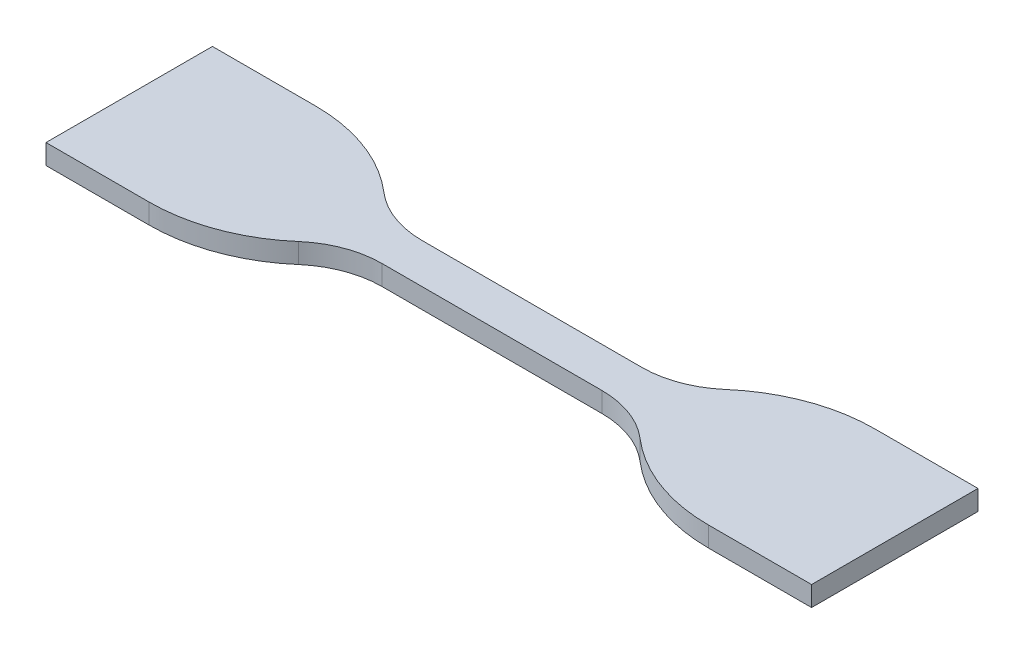
from build123d import *

# Parameters (mm, degrees)
BOSS_EXTRUDE1_DEPTH = 3


with BuildPart() as part:
    # Sketch3 → Boss-Extrude1 (new body)
    with BuildSketch(Plane(origin=(0, 0, 0), x_dir=(1, 0, 0), z_dir=(0, 1, 0))):
        with BuildLine():
            Line((0, 0), (-15.490197962, 0))
            Line((-15.490197962, 0), (-15.490197962, 25))
            Line((-15.490197962, 25), (0, 25))
            ThreePointArc((0, 25), (8.724780506, 23.428149844), (16.352437204, 18.91025641))
            ThreePointArc((16.352437204, 18.91025641), (20.623924954, 16.380236087), (25.509802038, 15.5))
            Line((25.509802038, 15.5), (58.509802038, 15.5))
            ThreePointArc((58.509802038, 15.5), (63.395679121, 16.380236087), (67.667166872, 18.91025641))
            ThreePointArc((67.667166872, 18.91025641), (75.29482357, 23.428149844), (84.019604075, 25))
            Line((84.019604075, 25), (99.509802038, 25))
            Line((99.509802038, 25), (99.509802038, 0))
            Line((99.509802038, 0), (84.019604075, 0))
            ThreePointArc((84.019604075, 0), (75.29482357, 1.571850156), (67.667166872, 6.08974359))
            ThreePointArc((67.667166872, 6.08974359), (63.395679121, 8.619763913), (58.509802038, 9.5))
            Line((58.509802038, 9.5), (25.509802038, 9.5))
            ThreePointArc((25.509802038, 9.5), (20.623924954, 8.619763913), (16.352437204, 6.08974359))
            ThreePointArc((16.352437204, 6.08974359), (8.724780506, 1.571850156), (0, 0))
        make_face()
    extrude(amount=BOSS_EXTRUDE1_DEPTH)


solid = part.part
